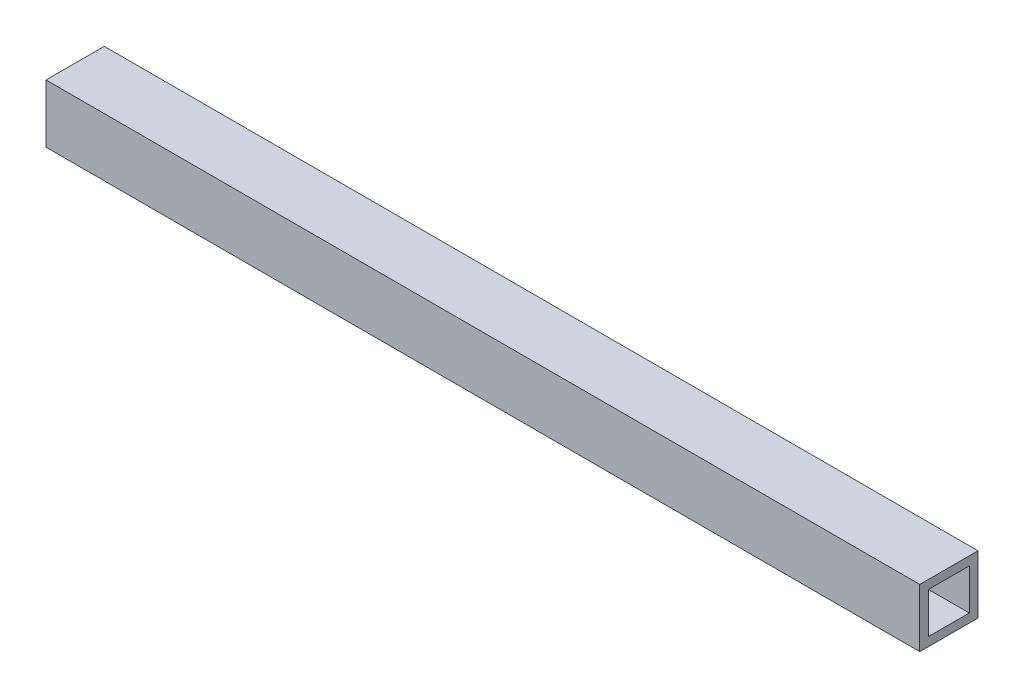
from build123d import *

# Parameters (mm, degrees)
CROQUIS1_W              = 150
CROQUIS1_H              = 10
SALIENTE_EXTRUIR1_DEPTH = 10
CROQUIS2_W              = 7
CROQUIS2_H              = 7
CORTAR_EXTRUIR1_DEPTH   = 151.166574177
CROQUIS3_W              = 0.02
CROQUIS3_H              = 4.666666667
CORTAR_EXTRUIR2_DEPTH   = 0.02
CROQUIS4_W              = 0.02
CROQUIS4_H              = 4.666666667
CORTAR_EXTRUIR3_DEPTH   = 0.02
CROQUIS5_W              = 0.02
CROQUIS5_H              = 4.666666667
CORTAR_EXTRUIR4_DEPTH   = 0.02
CROQUIS6_W              = 0.02
CROQUIS6_H              = 4.666666667
CORTAR_EXTRUIR5_DEPTH   = 0.02
CROQUIS7_W              = 0.02
CROQUIS7_H              = 4.666666667
CORTAR_EXTRUIR6_DEPTH   = 0.02
CROQUIS8_W              = 0.02
CROQUIS8_H              = 4.666666667
CORTAR_EXTRUIR7_DEPTH   = 0.02
CROQUIS9_W              = 0.02
CROQUIS9_H              = 4.666666667
CORTAR_EXTRUIR8_DEPTH   = 0.02
CROQUIS10_W             = 0.02
CROQUIS10_H             = 4.666666667
CORTAR_EXTRUIR9_DEPTH   = 0.02


with BuildPart() as part:
    # Croquis1 → Saliente-Extruir1 (new body)
    with BuildSketch(Plane.XZ.offset(5)):
        with Locations((75, 0)):
            Rectangle(CROQUIS1_W, CROQUIS1_H)
    extrude(amount=-SALIENTE_EXTRUIR1_DEPTH)

    # Croquis2 → Cortar-Extruir1 (cut, through all)
    with BuildSketch(Plane.ZY):
        Rectangle(CROQUIS2_W, CROQUIS2_H)
    extrude(amount=-CORTAR_EXTRUIR1_DEPTH, mode=Mode.SUBTRACT)

    # Croquis3 → Cortar-Extruir2 (cut)
    with BuildSketch(Plane.XY.offset(5)):
        with Locations((25, 1.166666666)):
            Rectangle(CROQUIS3_W, CROQUIS3_H)
    extrude(amount=-CORTAR_EXTRUIR2_DEPTH, mode=Mode.SUBTRACT)

    # Croquis4 → Cortar-Extruir3 (cut)
    with BuildSketch(Plane.XY.offset(5)):
        with Locations((35, 1.166666666)):
            Rectangle(CROQUIS4_W, CROQUIS4_H)
    extrude(amount=-CORTAR_EXTRUIR3_DEPTH, mode=Mode.SUBTRACT)

    # Croquis5 → Cortar-Extruir4 (cut)
    with BuildSketch(Plane.XY.offset(5)):
        with Locations((45, 1.166666666)):
            Rectangle(CROQUIS5_W, CROQUIS5_H)
    extrude(amount=-CORTAR_EXTRUIR4_DEPTH, mode=Mode.SUBTRACT)

    # Croquis6 → Cortar-Extruir5 (cut)
    with BuildSketch(Plane.XY.offset(5)):
        with Locations((55, 1.166666666)):
            Rectangle(CROQUIS6_W, CROQUIS6_H)
    extrude(amount=-CORTAR_EXTRUIR5_DEPTH, mode=Mode.SUBTRACT)

    # Croquis7 → Cortar-Extruir6 (cut)
    with BuildSketch(Plane.XY.offset(5)):
        with Locations((65, 1.166666666)):
            Rectangle(CROQUIS7_W, CROQUIS7_H)
    extrude(amount=-CORTAR_EXTRUIR6_DEPTH, mode=Mode.SUBTRACT)

    # Croquis8 → Cortar-Extruir7 (cut)
    with BuildSketch(Plane.XY.offset(5)):
        with Locations((75, 1.166666666)):
            Rectangle(CROQUIS8_W, CROQUIS8_H)
    extrude(amount=-CORTAR_EXTRUIR7_DEPTH, mode=Mode.SUBTRACT)

    # Croquis9 → Cortar-Extruir8 (cut)
    with BuildSketch(Plane.XY.offset(5)):
        with Locations((85, 1.166666666)):
            Rectangle(CROQUIS9_W, CROQUIS9_H)
    extrude(amount=-CORTAR_EXTRUIR8_DEPTH, mode=Mode.SUBTRACT)

    # Croquis10 → Cortar-Extruir9 (cut)
    with BuildSketch(Plane.XY.offset(5)):
        with Locations((15, 1.166666666)):
            Rectangle(CROQUIS10_W, CROQUIS10_H)
    extrude(amount=-CORTAR_EXTRUIR9_DEPTH, mode=Mode.SUBTRACT)


solid = part.part
